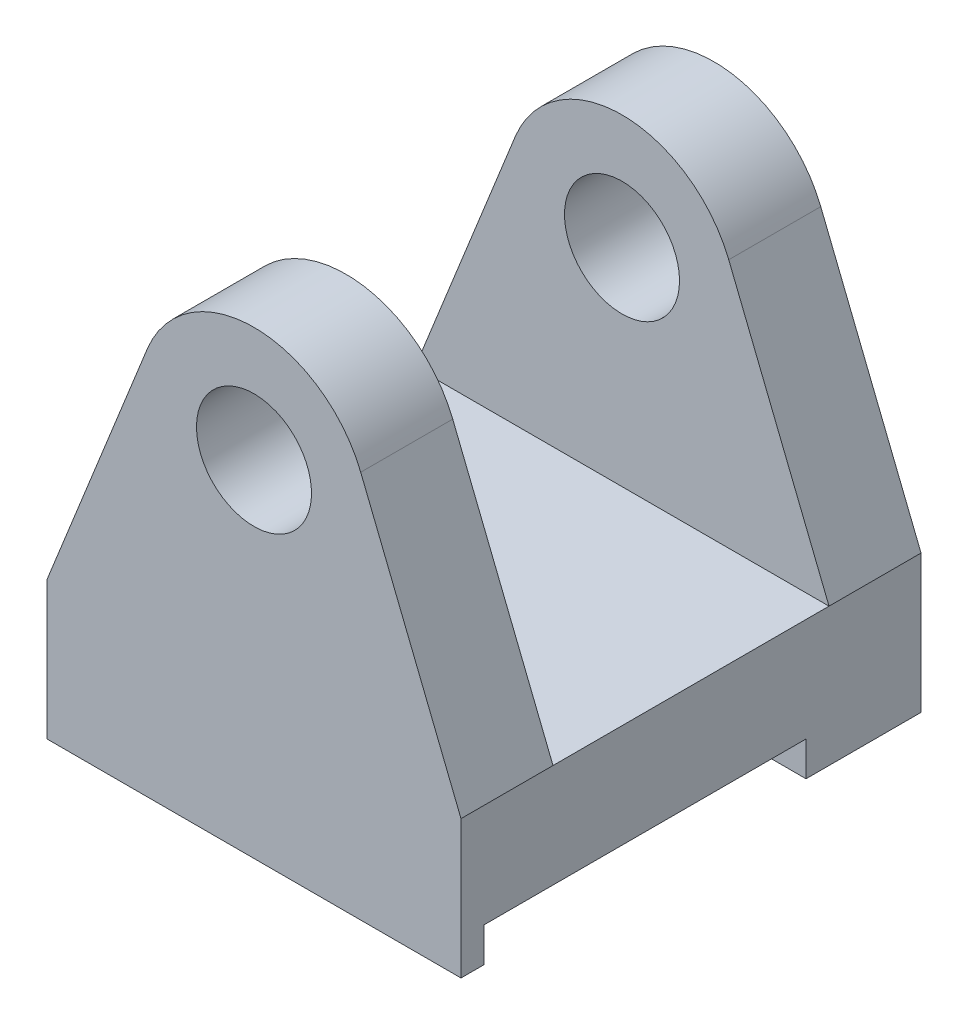
from build123d import *

# Parameters (mm, degrees)
SKETCH2_W           = 18
SKETCH2_H           = 20
BOSS_EXTRUDE1_DEPTH = 6
BOSS_EXTRUDE2_START = 10
SKETCH4_R           = 2.5
BOSS_EXTRUDE2_DEPTH = 4
BOSS_EXTRUDE3_START = -6
SKETCH4_2_R         = 2.5
BOSS_EXTRUDE3_DEPTH = 4
SKETCH5_W           = 14
SKETCH5_H           = 1.5
CUT_EXTRUDE1_DEPTH  = 29.705400189


with BuildPart() as part:
    # Sketch2 → Boss-Extrude1 (new body)
    with BuildSketch(Plane(origin=(0, 0, 0), x_dir=(1, 0, 0), z_dir=(0, 1, 0))):
        Rectangle(SKETCH2_W, SKETCH2_H)
    extrude(amount=BOSS_EXTRUDE1_DEPTH)

    # Sketch4 → Boss-Extrude2 (add)
    with BuildSketch(Plane.XY.offset(BOSS_EXTRUDE2_START)):
        with BuildLine():
            Line((-4.64019442, 16.862416642), (-9, 6))
            Line((-9, 6), (9, 6))
            Line((9, 6), (4.64019442, 16.862416642))
            ThreePointArc((4.64019442, 16.862416642), (0, 20), (-4.64019442, 16.862416642))
        make_face()
        with Locations(Location((0, 15, 0), (0, 0, 180))):
            Circle(SKETCH4_R, mode=Mode.SUBTRACT)
    extrude(amount=-BOSS_EXTRUDE2_DEPTH)

    # Sketch4<2> → Boss-Extrude3 (add)
    with BuildSketch(Plane.XY.offset(BOSS_EXTRUDE3_START)):
        with BuildLine():
            Line((-4.64019442, 16.862416642), (-9, 6))
            Line((-9, 6), (9, 6))
            Line((9, 6), (4.64019442, 16.862416642))
            ThreePointArc((4.64019442, 16.862416642), (0, 20), (-4.64019442, 16.862416642))
        make_face()
        with Locations(Location((0, 15, 0), (0, 0, 180))):
            Circle(SKETCH4_2_R, mode=Mode.SUBTRACT)
    extrude(amount=-BOSS_EXTRUDE3_DEPTH)

    # Sketch5 → Cut-Extrude1 (cut, through all)
    with BuildSketch(Plane.ZY.offset(9)):
        with Locations((2, 0.75)):
            Rectangle(SKETCH5_W, SKETCH5_H)
    extrude(amount=-CUT_EXTRUDE1_DEPTH, mode=Mode.SUBTRACT)


solid = part.part
